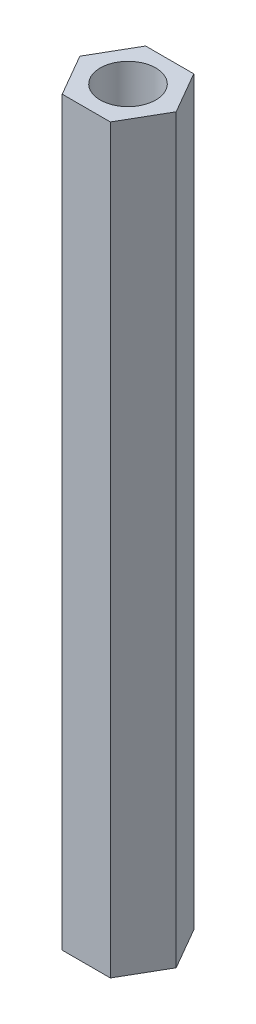
from build123d import *

# Parameters (mm, degrees)
SKETCH_1_R      = 1.5
EXTRUDE_1_DEPTH = 40


with BuildPart() as part:
    # 草图1 → 凸台-拉伸1 (new body)
    with BuildSketch(Plane(origin=(0, 0, 0), x_dir=(1, 0, 0), z_dir=(0, 1, 0))):
        Polygon((2.598076211, 0), (1.299038106, 2.25), (-1.299038106, 2.25), (-2.598076211, 0), (-1.299038106, -2.25), (1.299038106, -2.25), align=None)
        with Locations(Location((0, 0, 0), (0, 0, 270))):
            Circle(SKETCH_1_R, mode=Mode.SUBTRACT)
    extrude(amount=EXTRUDE_1_DEPTH)


solid = part.part
